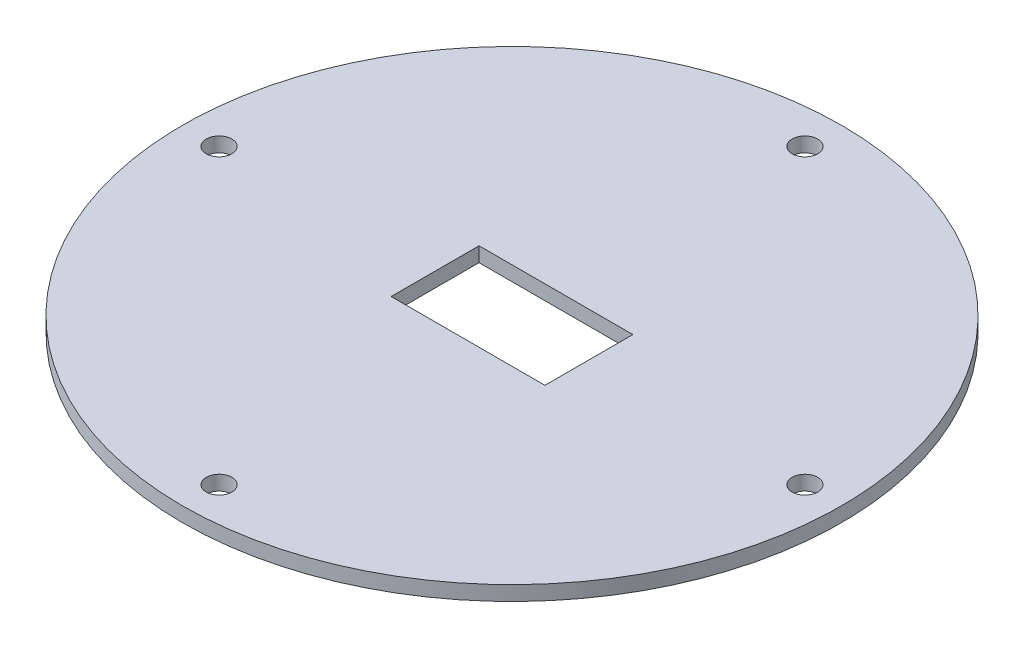
from build123d import *

# Parameters (mm, degrees)
SKETCH1_R           = 45
BOSS_EXTRUDE1_DEPTH = 2
SKETCH3_R           = 1.75
CUT_EXTRUDE1_DEPTH  = 64.671029519
SKETCH4_W           = 21
SKETCH4_H           = 12
CUT_EXTRUDE2_DEPTH  = 64.671029519


with BuildPart() as part:
    # Sketch1 → Boss-Extrude1 (new body)
    with BuildSketch(Plane(origin=(0, 0, 0), x_dir=(1, 0, 0), z_dir=(0, 1, 0))):
        with Locations(Location((0, 0, 0), (0, 0, 270))):
            Circle(SKETCH1_R)
    extrude(amount=BOSS_EXTRUDE1_DEPTH)

    # Sketch3 → Cut-Extrude1 (cut, through all)
    with BuildSketch(Plane(origin=(0, 2, 0), x_dir=(1, 0, 0), z_dir=(0, 1, 0))):
        with Locations(Location((0, 40, 0), (0, 0, 270))):
            Circle(SKETCH3_R)
        with Locations(Location((40, 0, 0), (0, 0, 270))):
            Circle(SKETCH3_R)
        with Locations(Location((0, -40, 0), (0, 0, 270))):
            Circle(SKETCH3_R)
        with Locations(Location((-40, 0, 0), (0, 0, 270))):
            Circle(SKETCH3_R)
    extrude(amount=-CUT_EXTRUDE1_DEPTH, mode=Mode.SUBTRACT)

    # Sketch4 → Cut-Extrude2 (cut, through all)
    with BuildSketch(Plane(origin=(0, 2, 0), x_dir=(1, 0, 0), z_dir=(0, 1, 0))):
        Rectangle(SKETCH4_W, SKETCH4_H)
    extrude(amount=-CUT_EXTRUDE2_DEPTH, mode=Mode.SUBTRACT)


solid = part.part
